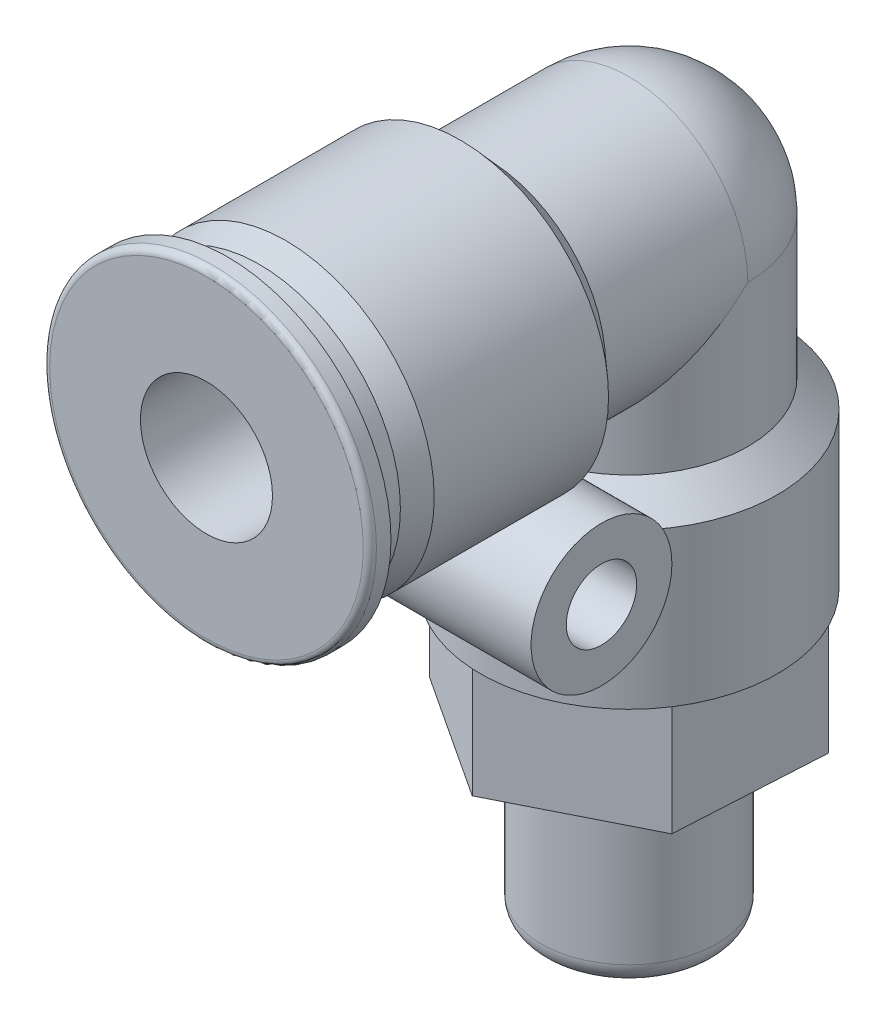
from build123d import *

# Parameters (mm, degrees)
SKETCH_3_R               = 3
CUT_EXTRUDE_1_DEPTH      = 19.2
EXTRUDE_1_DEPTH          = 6.75
EXTRUDE_1_DEPTH_BACK     = 6.75
SKETCH_5_R               = 3.2
CUT_EXTRUDE_2_DEPTH      = 6.75
CUT_EXTRUDE_2_DEPTH_BACK = 6.75
SKETCH_6_R               = 1.6
EXTRUDE_2_DEPTH          = 5
SKETCH_8_R               = 4
EXTRUDE_3_DEPTH          = 8
FILLET_1_R               = 1


with BuildPart() as part:
    # 草图1 → 旋转1 (revolve)
    with BuildSketch(Plane(origin=(0, 0, 0), x_dir=(0, 0, -1), z_dir=(1, 0, 0))):
        with BuildLine():
            Line((-19.2, 0), (-19.2, 7.125))
            ThreePointArc((-19.2, 7.125), (-19.112132034, 7.337132034), (-18.9, 7.425))
            Line((-18.9, 7.425), (-18.24, 7.425))
            Line((-18.24, 7.425), (-18.24, 4.5))
            Line((-18.24, 4.5), (-17.76, 4.5))
            Line((-17.76, 4.5), (-17.76, 6.2125))
            ThreePointArc((-17.76, 6.2125), (-17.701421356, 6.353921356), (-17.56, 6.4125))
            Line((-17.56, 6.4125), (-16.8, 6.4125))
            Line((-16.8, 6.4125), (-15.6, 6.75))
            Line((-15.6, 6.75), (-7.68, 6.75))
            Line((-7.68, 6.75), (-6.46445454, 5.4))
            Line((-6.46445454, 5.4), (0, 5.4))
            ThreePointArc((0, 5.4), (3.818376618, 3.818376618), (5.4, 0))
            Line((5.4, 0), (-19.2, 0))
        make_face()
    revolve(axis=Axis((0, 0, -5.4), (0, 0, 1)))

    # 草图2 → 旋转2 (revolve)
    with BuildSketch(Plane(origin=(0, 0, 0), x_dir=(0, 0, -1), z_dir=(1, 0, 0))):
        Polygon((-6.75, -14.728504785), (-6.75, -7.68), (-5.4, -6.46445454), (-5.4, 0), (0, 0), (0, -14.728504785), align=None)
    revolve(axis=Axis((0, 0, 0), (0, -1, 0)))

    # 草图3 → 切除-拉伸1 (cut)
    with BuildSketch(Plane.XY):
        Circle(SKETCH_3_R)
    extrude(amount=CUT_EXTRUDE_1_DEPTH, mode=Mode.SUBTRACT)

    # 草图5 → 凸台-拉伸1 (add, two sides: drawn at the far end of the back side and taken through both)
    with BuildSketch(Plane(origin=(0, 0, 0), x_dir=(0, 0, -1), z_dir=(1, 0, 0)).offset(-EXTRUDE_1_DEPTH_BACK)):
        with Locations((-8, -8)):
            Circle(SKETCH_5_R)
    extrude(amount=EXTRUDE_1_DEPTH + EXTRUDE_1_DEPTH_BACK)

    # 草图6 → 切除-拉伸2 (cut, two sides: drawn at the far end of the back side and taken through both)
    with BuildSketch(Plane(origin=(0, 0, 0), x_dir=(0, 0, -1), z_dir=(1, 0, 0)).offset(-CUT_EXTRUDE_2_DEPTH_BACK)):
        with Locations((-8, -8)):
            Circle(SKETCH_6_R)
    extrude(amount=CUT_EXTRUDE_2_DEPTH + CUT_EXTRUDE_2_DEPTH_BACK, mode=Mode.SUBTRACT)

    # 草图4 → 切除-旋转1 (revolve, cut)
    with BuildSketch(Plane(origin=(0, 0, 0), x_dir=(0, 0, -1), z_dir=(1, 0, 0))):
        with BuildLine():
            Line((3, 0), (3, -39.2))
            Line((3, -39.2), (0, -39.2))
            Line((0, -39.2), (0, 3))
            ThreePointArc((0, 3), (2.121320344, 2.121320344), (3, 0))
        make_face()
    revolve(axis=Axis((0, -19.2, 0), (0, 1, 0)), mode=Mode.SUBTRACT)

    # 草图7 → 凸台-拉伸2 (add)
    with BuildSketch(Plane.XZ.offset(14.728504785)):
        Polygon((-5.644667133, -3.701382574), (0.383157772, -6.73911642), (6.027824905, -3.037733846), (5.644667133, 3.701382574), (-0.383157772, 6.73911642), (-6.027824905, 3.037733846), align=None)
    extrude(amount=EXTRUDE_2_DEPTH)

    # 草图8 → 凸台-拉伸3 (add)
    with BuildSketch(Plane.XZ.offset(19.728504785)):
        Circle(SKETCH_8_R)
    extrude(amount=EXTRUDE_3_DEPTH)

    # 圆角1
    fillet_1_edges = [part.edges().sort_by_distance(p)[0] for p in [
        (-4, -27.728504785, 0),
    ]]
    fillet(fillet_1_edges, radius=FILLET_1_R)


solid = part.part
